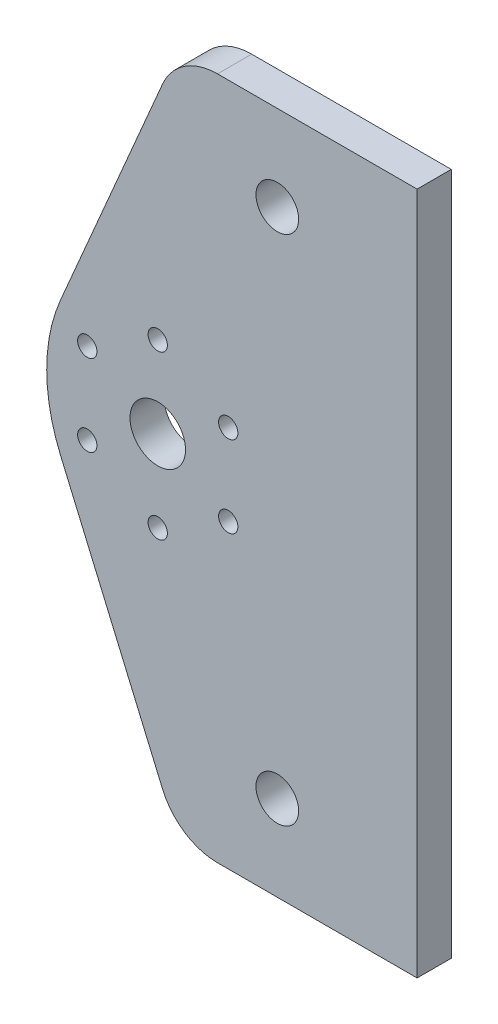
from build123d import *

# Parameters (mm, degrees)
SKETCH1_R                   = 2.5
SKETCH1_R_2                 = 3.25
BOSS_EXTRUDE1_DEPTH         = 2
TALADRO_ROSCADO_4_401_D     = 2.2606
TALADRO_ROSCADO_4_401_DEPTH = 12.7
TALADRO_ROSCADO_4_401_TIP   = 0.679152758


with BuildPart() as part:
    # Sketch1 → Boss-Extrude1 (new, symmetric)
    with BuildSketch(Plane.XY):
        with BuildLine():
            Line((0, -40), (0, 40))
            Line((0, 40), (-23.37, 40))
            ThreePointArc((-23.37, 40), (-27.223373178, 38.84392977), (-29.803954922, 35.757575758))
            Line((-29.803954922, 35.757575758), (-41.752728349, 7.878787879))
            ThreePointArc((-41.752728349, 7.878787879), (-43.37, 0), (-41.752728349, -7.878787879))
            Line((-41.752728349, -7.878787879), (-29.803954922, -35.757575758))
            ThreePointArc((-29.803954922, -35.757575758), (-27.223373178, -38.84392977), (-23.37, -40))
            Line((-23.37, -40), (0, -40))
        make_face()
        with Locations((-16.37, 30)):
            Circle(SKETCH1_R, mode=Mode.SUBTRACT)
        with Locations((-16.37, -30)):
            Circle(SKETCH1_R, mode=Mode.SUBTRACT)
        with Locations((-30.37, 0)):
            Circle(SKETCH1_R_2, mode=Mode.SUBTRACT)
    extrude(amount=BOSS_EXTRUDE1_DEPTH, both=True)

    # Taladro roscado #4-401
    with Locations(Plane.XY.offset(2)):
        with Locations((-30.37, -9.53), (-38.623222098, -4.765), (-38.623222098, 4.765), (-30.37, 9.53), (-22.116777902, 4.765), (-22.116777902, -4.765)):
            Hole(TALADRO_ROSCADO_4_401_D / 2, depth=TALADRO_ROSCADO_4_401_DEPTH)
            with Locations((0, 0, -(TALADRO_ROSCADO_4_401_DEPTH + TALADRO_ROSCADO_4_401_TIP / 2))):  # 118° drill point
                Cone(0, TALADRO_ROSCADO_4_401_D / 2, TALADRO_ROSCADO_4_401_TIP, mode=Mode.SUBTRACT)


solid = part.part
